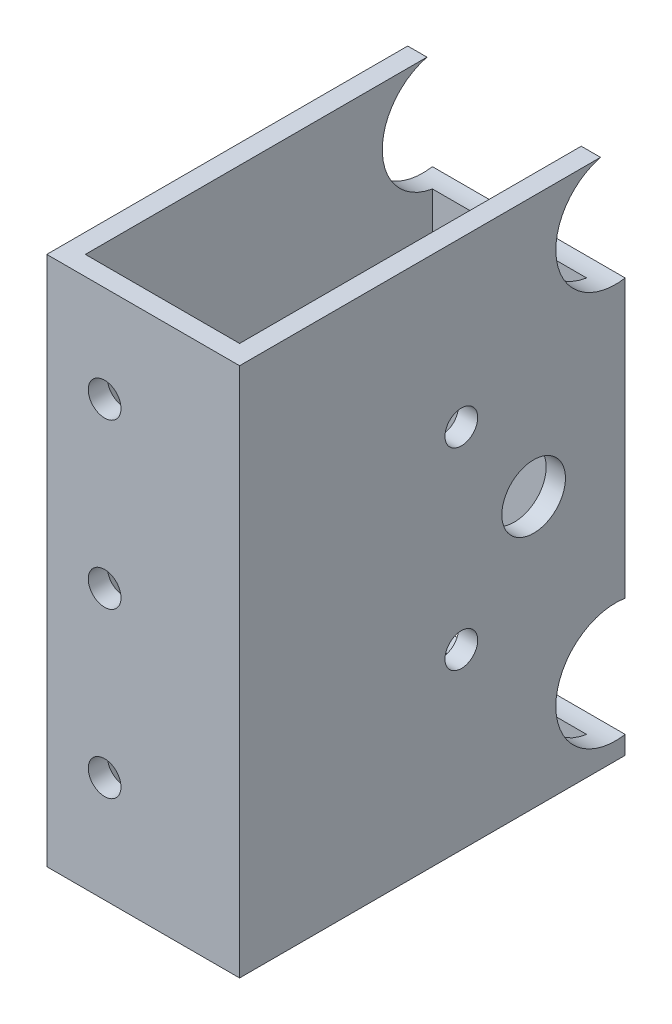
from build123d import *

# Parameters (mm, degrees)
STEEL_TUBE_STOCK_SKETCH_W        = 20
STEEL_TUBE_STOCK_SKETCH_H        = 55
STEEL_TUBE_STOCK_DEPTH           = 40
TUBE_INTERIOR_SKETCH_W           = 16
TUBE_INTERIOR_SKETCH_H           = 55.2
TUBE_INTERIOR_DEPTH              = 36
GUIDE_BUSH_CLEARANCE_1_SKETCH_R  = 6.2
GUIDE_BUSH_CLEARANCE_1_DEPTH     = 20.3
GUIDE_BUSH_CLEARANCE_2_SKETCH_R  = 6.2
GUIDE_BUSH_CLEARANCE_2_DEPTH     = 20.3
SCREW_THROUGH_CLEARANCE_SKETCH_R = 3.3
SCREW_THROUGH_CLEARANCE_DEPTH    = 20.3
SPRING_PIN_CLEARANCE_1_SKETCH_R  = 1.7
SPRING_PIN_CLEARANCE_1_DEPTH     = 2.2
SPRING_PIN_CLEARANCE_2_SKETCH_R  = 1.7
SPRING_PIN_CLEARANCE_2_DEPTH     = 2.2
SPRING_PIN_CLEARANCE_3_SKETCH_R  = 1.7
SPRING_PIN_CLEARANCE_3_DEPTH     = 2.2
CLAMP_BOLT_CLEARANCE_1_SKETCH_R  = 1.7
CLAMP_BOLT_CLEARANCE_1_DEPTH     = 2.3
CLAMP_BOLT_CLEARANCE_2_SKETCH_R  = 1.7
CLAMP_BOLT_CLEARANCE_2_DEPTH     = 2.3


with BuildPart() as part:
    # Steel tube stock sketch → Steel tube stock (new body)
    with BuildSketch(Plane.XY.offset(-29)):
        with Locations((39.708348754, -28.5)):
            Rectangle(STEEL_TUBE_STOCK_SKETCH_W, STEEL_TUBE_STOCK_SKETCH_H)
    extrude(amount=STEEL_TUBE_STOCK_DEPTH)

    # Tube interior sketch → Tube interior (cut)
    with BuildSketch(Plane.XY.offset(-27)):
        with Locations((39.708348754, -28.5)):
            Rectangle(TUBE_INTERIOR_SKETCH_W, TUBE_INTERIOR_SKETCH_H)
    extrude(amount=TUBE_INTERIOR_DEPTH, mode=Mode.SUBTRACT)

    # Guide bush clearance 1 sketch → Guide bush clearance 1 (cut)
    with BuildSketch(Plane(origin=(29.6, 0, 0), x_dir=(0, 0, -1), z_dir=(1, 0, 0))):
        with Locations((28, -9)):
            Circle(GUIDE_BUSH_CLEARANCE_1_SKETCH_R)
    extrude(amount=GUIDE_BUSH_CLEARANCE_1_DEPTH, mode=Mode.SUBTRACT)

    # Guide bush clearance 2 sketch → Guide bush clearance 2 (cut)
    with BuildSketch(Plane(origin=(29.6, 0, 0), x_dir=(0, 0, -1), z_dir=(1, 0, 0))):
        with Locations((28, -50)):
            Circle(GUIDE_BUSH_CLEARANCE_2_SKETCH_R)
    extrude(amount=GUIDE_BUSH_CLEARANCE_2_DEPTH, mode=Mode.SUBTRACT)

    # Screw through clearance sketch → Screw through clearance (cut)
    with BuildSketch(Plane(origin=(29.6, 0, 0), x_dir=(0, 0, -1), z_dir=(1, 0, 0))):
        with Locations(Location((19.5, -29, 0), (0, 0, 180))):
            Circle(SCREW_THROUGH_CLEARANCE_SKETCH_R)
    extrude(amount=SCREW_THROUGH_CLEARANCE_DEPTH, mode=Mode.SUBTRACT)

    # Spring pin clearance 1 sketch → Spring pin clearance 1 (cut)
    with BuildSketch(Plane.XY.offset(8.9)):
        with Locations((35.708348754, -12)):
            Circle(SPRING_PIN_CLEARANCE_1_SKETCH_R)
    extrude(amount=SPRING_PIN_CLEARANCE_1_DEPTH, mode=Mode.SUBTRACT)

    # Spring pin clearance 2 sketch → Spring pin clearance 2 (cut)
    with BuildSketch(Plane.XY.offset(8.9)):
        with Locations((35.708348754, -29)):
            Circle(SPRING_PIN_CLEARANCE_2_SKETCH_R)
    extrude(amount=SPRING_PIN_CLEARANCE_2_DEPTH, mode=Mode.SUBTRACT)

    # Spring pin clearance 3 sketch → Spring pin clearance 3 (cut)
    with BuildSketch(Plane.XY.offset(8.9)):
        with Locations((35.708348754, -46)):
            Circle(SPRING_PIN_CLEARANCE_3_SKETCH_R)
    extrude(amount=SPRING_PIN_CLEARANCE_3_DEPTH, mode=Mode.SUBTRACT)

    # Clamp bolt clearance 1 sketch → Clamp bolt clearance 1 (cut)
    with BuildSketch(Plane(origin=(47.6, 0, 0), x_dir=(0, 0, -1), z_dir=(1, 0, 0))):
        with Locations(Location((12, -19, 0), (0, 0, 180))):
            Circle(CLAMP_BOLT_CLEARANCE_1_SKETCH_R)
    extrude(amount=CLAMP_BOLT_CLEARANCE_1_DEPTH, mode=Mode.SUBTRACT)

    # Clamp bolt clearance 2 sketch → Clamp bolt clearance 2 (cut)
    with BuildSketch(Plane(origin=(47.6, 0, 0), x_dir=(0, 0, -1), z_dir=(1, 0, 0))):
        with Locations(Location((12, -39, 0), (0, 0, 180))):
            Circle(CLAMP_BOLT_CLEARANCE_2_SKETCH_R)
    extrude(amount=CLAMP_BOLT_CLEARANCE_2_DEPTH, mode=Mode.SUBTRACT)


with BuildPart() as body_2:
    # Mirror1: mirrored copy
    add(part.part.mirror(Plane(origin=(0, 0, 0), x_dir=(0, 0, 1), z_dir=(0, -1, 0))))


solid = body_2.part
